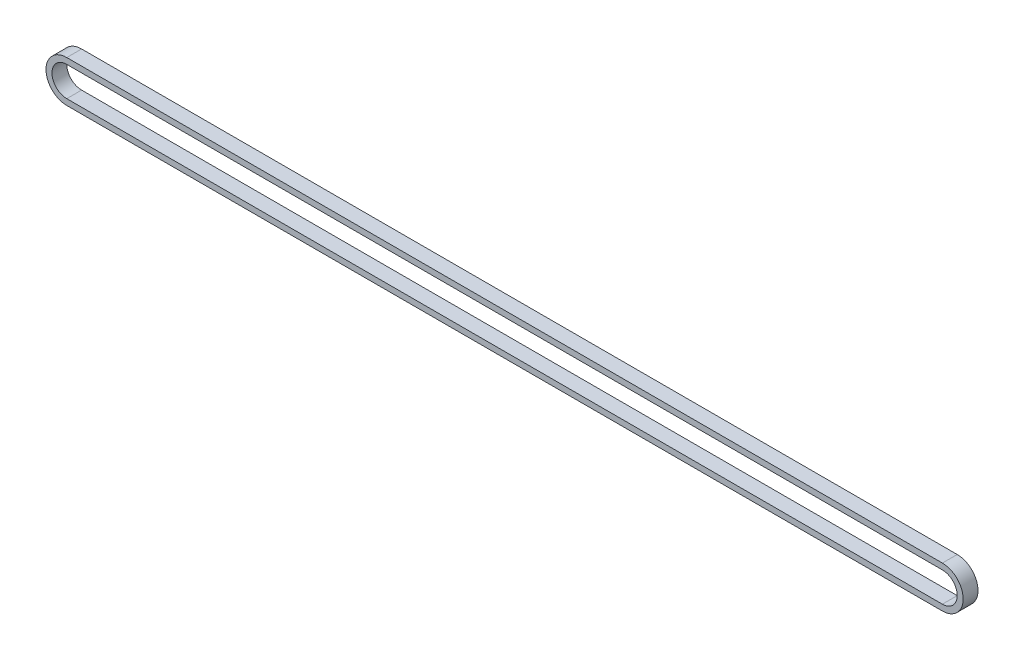
from build123d import *

# Parameters (mm, degrees)
BOSS_EXTRUDE1_DEPTH = 10


with BuildPart() as part:
    # Sketch1 → Boss-Extrude1 (new body)
    with BuildSketch(Plane.XY):
        with BuildLine():
            Line((-281.746298651, 158.119878604), (308.253701349, 158.119878604))
            ThreePointArc((308.253701349, 158.119878604), (322.253701349, 144.119878604), (308.253701349, 130.119878604))
            Line((308.253701349, 130.119878604), (-281.746298651, 130.119878604))
            ThreePointArc((-281.746298651, 130.119878604), (-295.746298651, 144.119878604), (-281.746298651, 158.119878604))
        make_face()
        with BuildLine():
            Line((-281.746298651, 154.119878604), (308.253701349, 154.119878604))
            ThreePointArc((308.253701349, 154.119878604), (318.253701349, 144.119878604), (308.253701349, 134.119878604))
            Line((308.253701349, 134.119878604), (-281.746298651, 134.119878604))
            ThreePointArc((-281.746298651, 134.119878604), (-291.746298651, 144.119878604), (-281.746298651, 154.119878604))
        make_face(mode=Mode.SUBTRACT)
    extrude(amount=BOSS_EXTRUDE1_DEPTH)


solid = part.part
